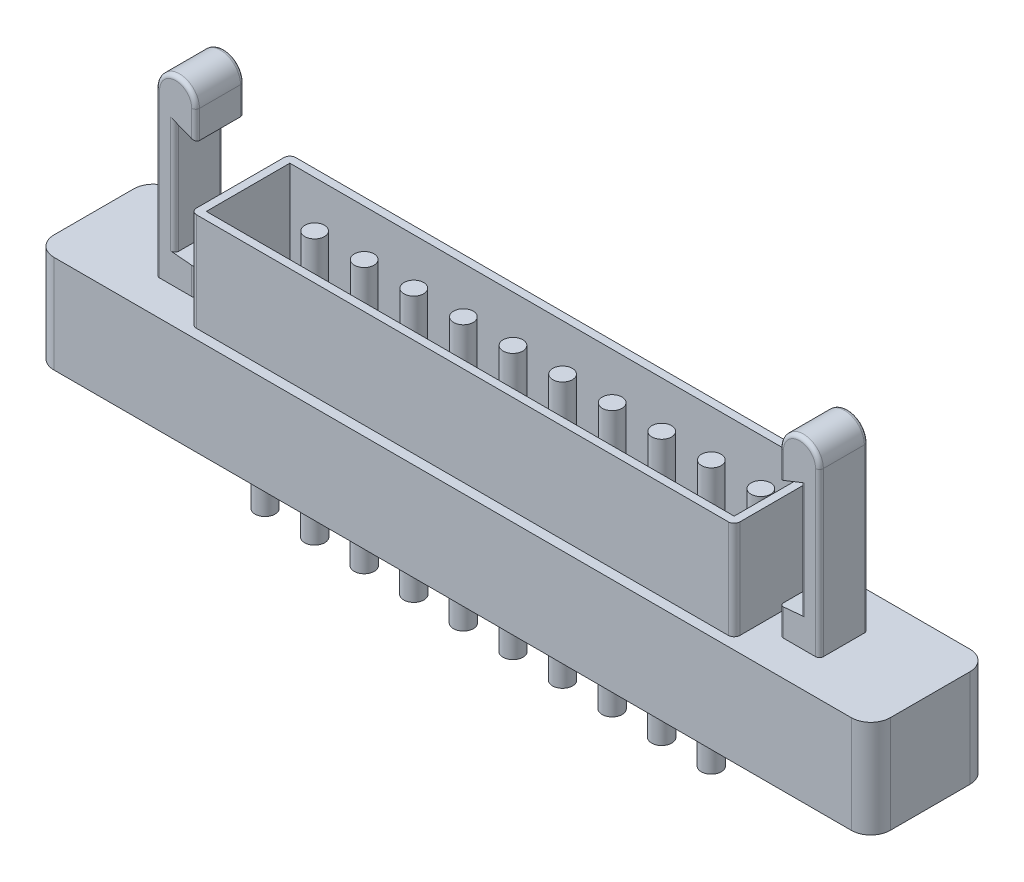
from build123d import *

# Parameters (mm, degrees)
SKETCH_2_W             = 38.1
SKETCH_2_H             = 1
EXTRUDE_1_DEPTH        = 5.08
SKETCH_3_R             = 0.514113779
SKETCH_3_R_2           = 0.502427848
EXTRUDE_2_DEPTH        = 2.5
PATTERN_LINEAR_1_COUNT = 10
PATTERN_LINEAR_1_PITCH = 2.54
SKETCH_4_W             = 44.198683318
SKETCH_4_H             = 8.471214157
CUT_EXTRUDE_1_DEPTH    = 5.08
EXTRUDE_START          = 6
SKETCH_5_R             = 0.502427848
SKETCH_5_R_2           = 0.514113779
EXTRUDE_3_DEPTH        = 6
SKETCH_6_W             = 51.24
SKETCH_6_H             = 6.08
EXTRUDE_4_DEPTH        = 2.4
SKETCH_7_W             = 27.84
SKETCH_7_H             = 5.08
SKETCH_7_W_2           = 27.04
SKETCH_7_H_2           = 4.28
EXTRUDE_6_DEPTH        = 7.5
SKETCH_8_W             = 51.24
SKETCH_8_H             = 6.08
EXTRUDE_7_DEPTH        = 2.6
EXTRUDE_8_DEPTH        = 1.25
EXTRUDE_8_DEPTH_BACK   = 1.25
FILLET_1_R             = 0.3
FILLET_2_R             = 0.2
SKETCH_10_W            = 6.08
SKETCH_10_H            = 5
CUT_EXTRUDE_2_DEPTH    = 13.4
SKETCH_11_W            = 6.08
SKETCH_11_H            = 5
EXTRUDE_9_DEPTH        = 2.5
SKETCH_12_W            = 6.08
SKETCH_12_H            = 5
EXTRUDE_10_DEPTH       = 2.5
FILLET_3_R             = 1


with BuildPart() as part:
    # Эскиз2 → Вытянуть1 (new body)
    with BuildSketch(Plane.XY):
        Polygon((0, 0), (41.24, 0), (41.24, 2.54), (40.94, 2.54), (40.94, 3.34), (41.24, 3.34), (41.24, 7.62), (0, 7.62), (0, 3.34), (0.3, 3.34), (0.3, 2.54), (0, 2.54), align=None)
        with Locations((20.62, 5.5)):
            Rectangle(SKETCH_2_W, SKETCH_2_H, mode=Mode.SUBTRACT)
    extrude(amount=EXTRUDE_1_DEPTH)

    # Эскиз3 → Вытянуть2 (add)
    with BuildSketch(Plane.XZ):
        with Locations(Location((2.54, 3.81, 0), (0, 0, 90))):
            Circle(SKETCH_3_R)
        with Locations(Location((2.54, 1.27, 0), (0, 0, 90))):
            Circle(SKETCH_3_R_2)
    extrude_2 = extrude(amount=EXTRUDE_2_DEPTH)

    # Линейный массив1: Вытянуть2 ×10
    with Locations(*[(i * PATTERN_LINEAR_1_PITCH, 0, 0) for i in range(1, PATTERN_LINEAR_1_COUNT)]):
        add(extrude_2)

    # Эскиз4 → Вырез-Вытянуть1 (cut)
    with BuildSketch(Plane(origin=(0, 7.62, 0), x_dir=(-1, 0, 0), z_dir=(0, 1, 0))):
        with Locations((-20.961321946, 2.444099463)):
            Rectangle(SKETCH_4_W, SKETCH_4_H)
    extrude(amount=-CUT_EXTRUDE_1_DEPTH, mode=Mode.SUBTRACT)

    # Эскиз5 → Вытянуть3 (add)
    with BuildSketch(Plane(origin=(0, 2.54, 0), x_dir=(-1, 0, 0), z_dir=(0, 1, 0)).offset(EXTRUDE_START)):
        with Locations(Location((-15.24, 1.27, 0), (0, 0, 90))):
            Circle(SKETCH_5_R)
        with Locations(Location((-15.24, 3.81, 0), (0, 0, 90))):
            Circle(SKETCH_5_R_2)
        with Locations(Location((-17.78, 1.27, 0), (0, 0, 90))):
            Circle(SKETCH_5_R)
        with Locations(Location((-17.78, 3.81, 0), (0, 0, 90))):
            Circle(SKETCH_5_R_2)
        with Locations(Location((-20.32, 1.27, 0), (0, 0, 90))):
            Circle(SKETCH_5_R)
        with Locations(Location((-20.32, 3.81, 0), (0, 0, 90))):
            Circle(SKETCH_5_R_2)
        with Locations(Location((-22.86, 1.27, 0), (0, 0, 90))):
            Circle(SKETCH_5_R)
        with Locations(Location((-12.7, 3.81, 0), (0, 0, 90))):
            Circle(SKETCH_5_R_2)
        with Locations(Location((-10.16, 3.81, 0), (0, 0, 90))):
            Circle(SKETCH_5_R_2)
        with Locations(Location((-7.62, 3.81, 0), (0, 0, 90))):
            Circle(SKETCH_5_R_2)
        with Locations(Location((-5.08, 3.81, 0), (0, 0, 90))):
            Circle(SKETCH_5_R_2)
        with Locations(Location((-2.54, 3.81, 0), (0, 0, 90))):
            Circle(SKETCH_5_R_2)
        with Locations(Location((-2.54, 1.27, 0), (0, 0, 90))):
            Circle(SKETCH_5_R)
        with Locations(Location((-5.08, 1.27, 0), (0, 0, 90))):
            Circle(SKETCH_5_R)
        with Locations(Location((-7.62, 1.27, 0), (0, 0, 90))):
            Circle(SKETCH_5_R)
        with Locations(Location((-10.16, 1.27, 0), (0, 0, 90))):
            Circle(SKETCH_5_R)
        with Locations(Location((-12.7, 1.27, 0), (0, 0, 90))):
            Circle(SKETCH_5_R)
        with Locations(Location((-22.86, 3.81, 0), (0, 0, 90))):
            Circle(SKETCH_5_R_2)
        with Locations(Location((-25.4, 1.27, 0), (0, 0, 90))):
            Circle(SKETCH_5_R)
        with Locations(Location((-25.4, 3.81, 0), (0, 0, 90))):
            Circle(SKETCH_5_R_2)
    extrude(amount=-EXTRUDE_3_DEPTH)

    # Эскиз6 → Вытянуть4 (add)
    with BuildSketch(Plane.XZ):
        with Locations((20.62, 2.54)):
            Rectangle(SKETCH_6_W, SKETCH_6_H)
    extrude(amount=-EXTRUDE_4_DEPTH)

    # Эскиз7 → Вытянуть6 (add)
    with BuildSketch(Plane(origin=(0, 2.54, 0), x_dir=(-1, 0, 0), z_dir=(0, 1, 0))):
        with Locations((-13.92, 2.54)):
            Rectangle(SKETCH_7_W, SKETCH_7_H)
        with Locations((-13.92, 2.54)):
            Rectangle(SKETCH_7_W_2, SKETCH_7_H_2, mode=Mode.SUBTRACT)
    extrude(amount=EXTRUDE_6_DEPTH)

    # Эскиз8 → Вытянуть7 (add)
    with BuildSketch(Plane(origin=(0, 2.4, 0), x_dir=(-1, 0, 0), z_dir=(0, 1, 0))):
        with Locations((-20.62, 2.54)):
            Rectangle(SKETCH_8_W, SKETCH_8_H)
    extrude(amount=EXTRUDE_7_DEPTH)

    # Эскиз9 → Вытянуть8 (add, two sides: drawn at the far end of the back side and taken through both)
    with BuildSketch(Plane.XY.offset(2.54).offset(-EXTRUDE_8_DEPTH_BACK)):
        with BuildLine():
            Line((-3.08, 2.225086662), (-1.038499325, 2.225086662))
            Line((-1.038499325, 2.225086662), (-1.038499325, 6.369811339))
            Line((-1.038499325, 6.369811339), (-2.112614583, 6.464724855))
            Line((-2.112614583, 6.464724855), (-2.112614583, 12.347438775))
            Line((-2.112614583, 12.347438775), (-1.038499325, 11.921130469))
            Line((-1.038499325, 11.921130469), (-1.038499325, 13.347619973))
            ThreePointArc((-1.038499325, 13.347619973), (-2.059249663, 14.368370311), (-3.08, 13.347619973))
            Line((-3.08, 13.347619973), (-3.08, 2.225086662))
        make_face()
        with BuildLine():
            Line((28.878499325, 11.921130469), (28.878499325, 13.347619973))
            ThreePointArc((28.878499325, 13.347619973), (29.899249663, 14.368370311), (30.92, 13.347619973))
            Line((30.92, 13.347619973), (30.92, 2.225086662))
            Line((30.92, 2.225086662), (28.878499325, 2.225086662))
            Line((28.878499325, 2.225086662), (28.878499325, 6.369811339))
            Line((28.878499325, 6.369811339), (29.952614583, 6.464724855))
            Line((29.952614583, 6.464724855), (29.952614583, 12.347438775))
            Line((29.952614583, 12.347438775), (28.878499325, 11.921130469))
        make_face()
    extrude(amount=EXTRUDE_8_DEPTH + EXTRUDE_8_DEPTH_BACK)

    # Скругление1
    fillet_1_edges = [part.edges().sort_by_distance(p)[0] for p in [
        (0, 7.52, 0),
        (27.84, 7.52, 5.08),
        (27.84, 7.52, 0),
        (0, 7.52, 5.08),
    ]]
    fillet(fillet_1_edges, radius=FILLET_1_R)

    # Скругление2
    fillet_2_edges = [part.edges().sort_by_distance(p)[0] for p in [
        (-3.08, 9.173809987, 1.29),
        (-1.038499325, 5.684905669, 1.29),
        (-3.08, 9.173809987, 3.79),
        (-1.038499325, 5.684905669, 3.79),
        (-2.112614583, 9.406081815, 3.79),
        (-1.038499325, 12.634375221, 3.79),
        (-2.059249663, 14.368370311, 3.79),
        (-2.112614583, 9.406081815, 1.29),
        (-1.038499325, 12.634375221, 1.29),
        (-2.059249663, 14.368370311, 1.29),
        (28.878499325, 5.684905669, 1.29),
        (30.92, 9.173809987, 1.29),
        (30.92, 9.173809987, 3.79),
        (29.899249663, 14.368370311, 3.79),
        (28.878499325, 12.634375221, 3.79),
        (29.952614583, 9.406081815, 3.79),
        (28.878499325, 5.684905669, 3.79),
        (29.899249663, 14.368370311, 1.29),
        (28.878499325, 12.634375221, 1.29),
        (29.952614583, 9.406081815, 1.29),
    ]]
    fillet(fillet_2_edges, radius=FILLET_2_R)

    # Эскиз10 → Вырез-Вытянуть2 (cut)
    with BuildSketch(Plane(origin=(46.24, 0, 0), x_dir=(0, 0, -1), z_dir=(1, 0, 0))):
        with Locations((-2.54, 2.5)):
            Rectangle(SKETCH_10_W, SKETCH_10_H)
    extrude(amount=-CUT_EXTRUDE_2_DEPTH, mode=Mode.SUBTRACT)

    # Эскиз11 → Вытянуть9 (add)
    with BuildSketch(Plane(origin=(32.84, 0, 0), x_dir=(0, 0, -1), z_dir=(1, 0, 0))):
        with Locations((-2.54, 2.5)):
            Rectangle(SKETCH_11_W, SKETCH_11_H)
    extrude(amount=EXTRUDE_9_DEPTH)

    # Эскиз12 → Вытянуть10 (add)
    with BuildSketch(Plane.ZY.offset(5)):
        with Locations((2.54, 2.5)):
            Rectangle(SKETCH_12_W, SKETCH_12_H)
    extrude(amount=EXTRUDE_10_DEPTH)

    # Скругление3
    fillet_3_edges = [part.edges().sort_by_distance(p)[0] for p in [
        (35.34, 2.5, 5.58),
        (35.34, 2.5, -0.5),
        (-7.5, 2.5, -0.5),
        (-7.5, 2.5, 5.58),
    ]]
    fillet(fillet_3_edges, radius=FILLET_3_R)


solid = part.part
